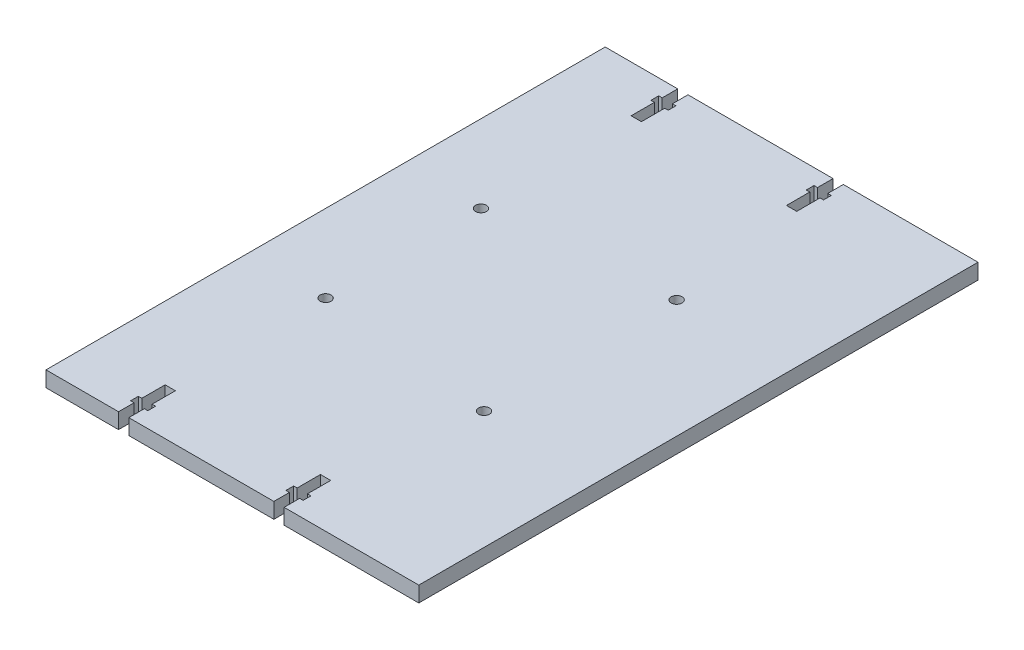
from build123d import *

# Parameters (mm, degrees)
SKETCH1_W           = 120
SKETCH1_H           = 180
BOSS_EXTRUDE1_DEPTH = 5
CUT_EXTRUDE1_DEPTH  = 5
SKETCH3_R           = 1.75
CUT_EXTRUDE2_DEPTH  = 5


with BuildPart() as part:
    # Sketch1 → Boss-Extrude1 (new body)
    with BuildSketch(Plane(origin=(0, 0, 0), x_dir=(1, 0, 0), z_dir=(0, 1, 0))):
        with Locations((60, 90)):
            Rectangle(SKETCH1_W, SKETCH1_H)
    extrude(amount=BOSS_EXTRUDE1_DEPTH)

    # Sketch2 → Cut-Extrude1 (cut)
    with BuildSketch(Plane(origin=(0, 5, 0), x_dir=(1, 0, 0), z_dir=(0, 1, 0))):
        Polygon((23.35, 15), (26.65, 15), (26.65, 7.5), (27.775, 7.5), (27.775, 5), (26.65, 5), (26.65, 0), (23.35, 0), (23.35, 5), (22.225, 5), (22.225, 7.5), (23.35, 7.5), align=None)
        Polygon((76.65, 15), (76.65, 7.5), (77.775, 7.5), (77.775, 5), (76.65, 5), (76.65, 0), (73.35, 0), (73.35, 5), (72.225, 5), (72.225, 7.5), (73.35, 7.5), (73.35, 15), align=None)
        Polygon((76.65, 165), (73.35, 165), (73.35, 172.5), (72.225, 172.5), (72.225, 175), (73.35, 175), (73.35, 180), (76.65, 180), (76.65, 175), (77.775, 175), (77.775, 172.5), (76.65, 172.5), align=None)
        Polygon((23.35, 165), (23.35, 172.5), (22.225, 172.5), (22.225, 175), (23.35, 175), (23.35, 180), (26.65, 180), (26.65, 175), (27.775, 175), (27.775, 172.5), (26.65, 172.5), (26.65, 165), align=None)
    extrude(amount=-CUT_EXTRUDE1_DEPTH, mode=Mode.SUBTRACT)

    # Sketch3 → Cut-Extrude2 (cut)
    with BuildSketch(Plane(origin=(0, 5, 0), x_dir=(1, 0, 0), z_dir=(0, 1, 0))):
        with Locations(Location((25, 65, 0), (0, 0, 270))):
            Circle(SKETCH3_R)
        with Locations(Location((82, 59, 0), (0, 0, 270))):
            Circle(SKETCH3_R)
        with Locations(Location((25, 115, 0), (0, 0, 270))):
            Circle(SKETCH3_R)
        with Locations(Location((82, 121, 0), (0, 0, 270))):
            Circle(SKETCH3_R)
    extrude(amount=-CUT_EXTRUDE2_DEPTH, mode=Mode.SUBTRACT)


solid = part.part
